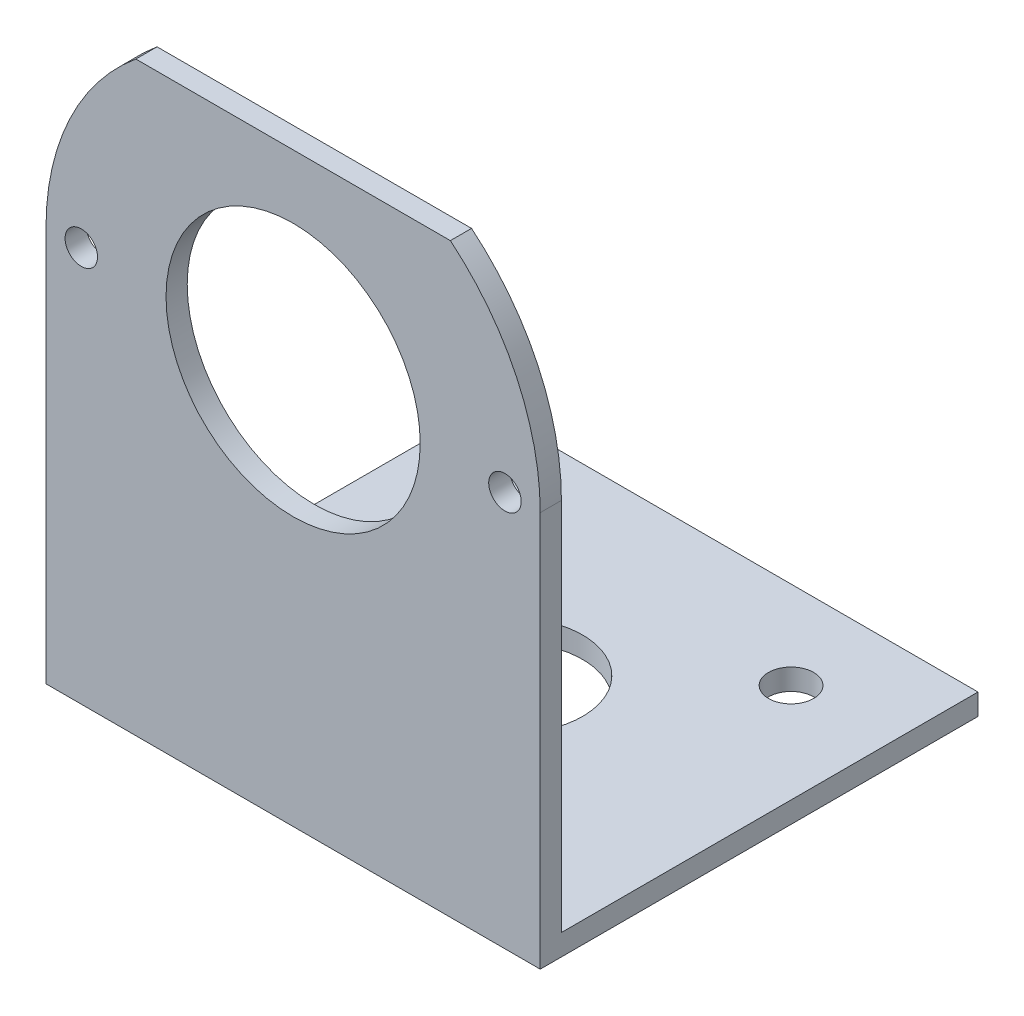
from build123d import *

# Parameters (mm, degrees)
ESQUISSE1_W             = 35
ESQUISSE1_H             = 31
ESQUISSE1_R             = 1.6
ESQUISSE1_R_2           = 5
BOSS_EXTRU_1_DEPTH      = 1.5
ESQUISSE2_W             = 35
ESQUISSE2_H             = 1.5
BOSS_EXTRU_2_DEPTH      = 40
ENL_V_MAT_EXTRU_1_DEPTH = 32.5
ESQUISSE4_R             = 9
ESQUISSE4_R_2           = 1.15
ENL_V_MAT_EXTRU_2_DEPTH = 32.5


with BuildPart() as part:
    # Esquisse1 → Boss.-Extru.1 (new body)
    with BuildSketch(Plane(origin=(0, 0, 0), x_dir=(1, 0, 0), z_dir=(0, 1, 0))):
        Rectangle(ESQUISSE1_W, ESQUISSE1_H)
        with Locations(Location((-10.480234522, 9.282493434, 0), (0, 0, 270))):
            Circle(ESQUISSE1_R, mode=Mode.SUBTRACT)
        with Locations(Location((0, 0, 0), (0, 0, 270))):
            Circle(ESQUISSE1_R_2, mode=Mode.SUBTRACT)
        with Locations(Location((10.480234522, 9.282493434, 0), (0, 0, 90))):
            Circle(ESQUISSE1_R, mode=Mode.SUBTRACT)
        with Locations(Location((10.480234522, -9.282493434, 0), (0, 0, 270))):
            Circle(ESQUISSE1_R, mode=Mode.SUBTRACT)
        with Locations(Location((-10.480234522, -9.282493434, 0), (0, 0, 90))):
            Circle(ESQUISSE1_R, mode=Mode.SUBTRACT)
    extrude(amount=BOSS_EXTRU_1_DEPTH)

    # Esquisse2 → Boss.-Extru.2 (add)
    with BuildSketch(Plane(origin=(0, 1.5, 0), x_dir=(1, 0, 0), z_dir=(0, 1, 0))):
        with Locations((0, -14.75)):
            Rectangle(ESQUISSE2_W, ESQUISSE2_H)
    extrude(amount=BOSS_EXTRU_2_DEPTH)

    # Esquisse3 → Enlèv. mat.-Extru.1 (cut)
    with BuildSketch(Plane.XY.offset(15.5)):
        with BuildLine():
            Line((-17.5, 41.5), (-17.5, 28))
            ThreePointArc((-17.5, 28), (-15.829114832, 35.462514566), (-11.135528726, 41.5))
            Line((-11.135528726, 41.5), (-17.5, 41.5))
        make_face()
        with BuildLine():
            Line((17.5, 41.5), (11.135528726, 41.5))
            ThreePointArc((11.135528726, 41.5), (15.829114832, 35.462514566), (17.5, 28))
            Line((17.5, 28), (17.5, 41.5))
        make_face()
    extrude(amount=-ENL_V_MAT_EXTRU_1_DEPTH, mode=Mode.SUBTRACT)

    # Esquisse4 → Enlèv. mat.-Extru.2 (cut)
    with BuildSketch(Plane.XY.offset(15.5)):
        with Locations((0, 28)):
            Circle(ESQUISSE4_R)
        with Locations((-15, 28)):
            Circle(ESQUISSE4_R_2)
        with Locations((15, 28)):
            Circle(ESQUISSE4_R_2)
    extrude(amount=-ENL_V_MAT_EXTRU_2_DEPTH, mode=Mode.SUBTRACT)


solid = part.part
